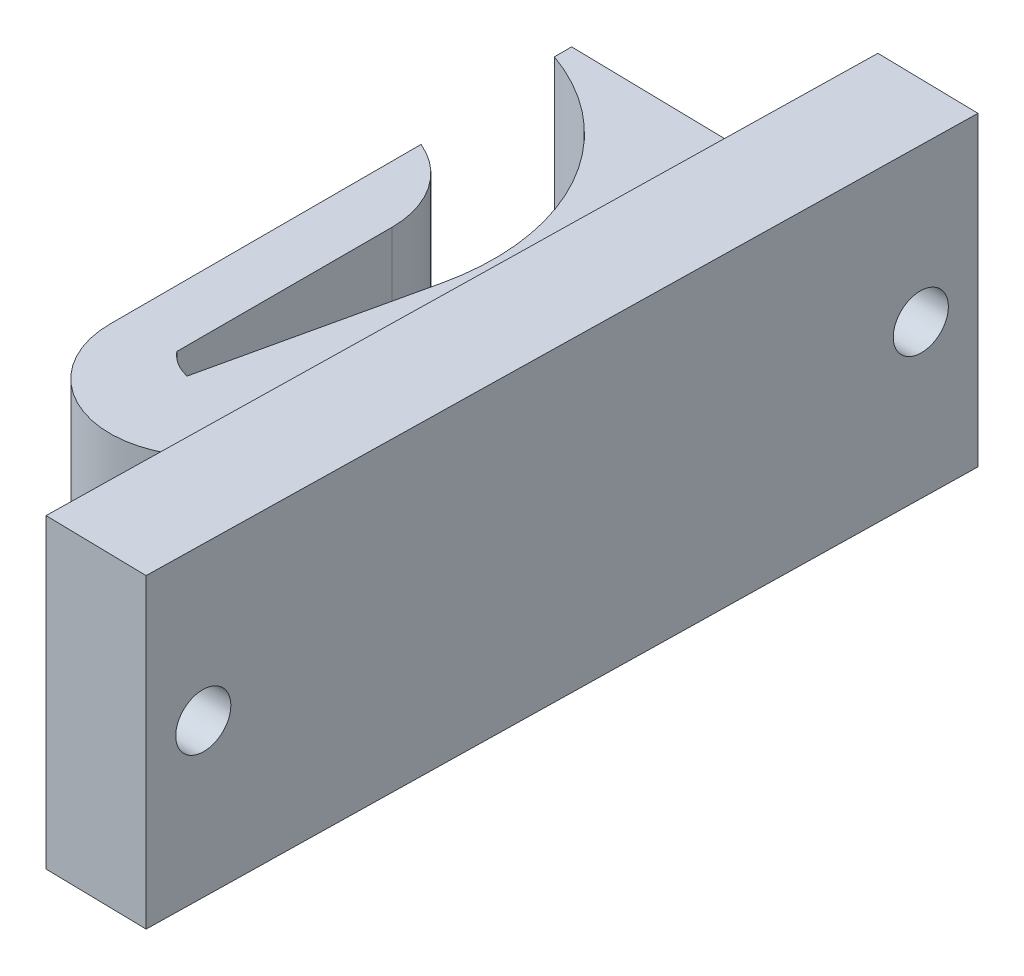
from build123d import *

# Parameters (mm, degrees)
BOSS_EXTRUDE1_DEPTH = 25
SKETCH4_W           = 80
SKETCH4_H           = 30
SKETCH4_R           = 2.651056997
BOSS_EXTRUDE4_DEPTH = 10


with BuildPart() as part:
    # Sketch1 → Boss-Extrude1 (new body)
    with BuildSketch(Plane(origin=(0, 0, 0), x_dir=(1, 0, 0), z_dir=(0, 1, 0))):
        with BuildLine():
            Line((18.424541272, -35.177357689), (23.005994318, -14.800530945))
            ThreePointArc((23.005994318, -14.800530945), (20.864784183, 0.157407238), (9.326512498, 9.914096331))
            Line((9.326512498, 9.914096331), (9.326512498, 11.603851187))
            Line((9.326512498, 11.603851187), (26.937532501, 11.267061467))
            Line((26.937532501, 11.267061467), (25.932986747, -41.261487659))
            ThreePointArc((25.932986747, -41.261487659), (15.860542773, -43.070975474), (10.227869895, -34.526891555))
            Line((10.227869895, -34.526891555), (10.227869895, -4.048540158))
            ThreePointArc((10.227869895, -4.048540158), (14.304101202, -7.422369294), (15.833057178, -12.488006305))
            Line((15.833057178, -12.488006305), (15.833057178, -33.589930418))
            ThreePointArc((15.833057178, -33.589930418), (16.997270485, -34.598365473), (18.424541272, -35.177357689))
        make_face()
    extrude(amount=BOSS_EXTRUDE1_DEPTH)

    # Sketch4 → Boss-Extrude4 (add)
    with BuildSketch(Plane(origin=(26.712294191, 0, 0.510840717), x_dir=(0.0191203094367821, 0, -0.9998171901738045), z_dir=(0.9998171901738045, 0, 0.0191203094367821))):
        with Locations((-15.719944306, 12.3)):
            Rectangle(SKETCH4_W, SKETCH4_H)
        with Locations((-50.219944306, 12.3)):
            Circle(SKETCH4_R, mode=Mode.SUBTRACT)
        with Locations((18.780055694, 12.3)):
            Circle(SKETCH4_R, mode=Mode.SUBTRACT)
    extrude(amount=BOSS_EXTRUDE4_DEPTH)


solid = part.part
